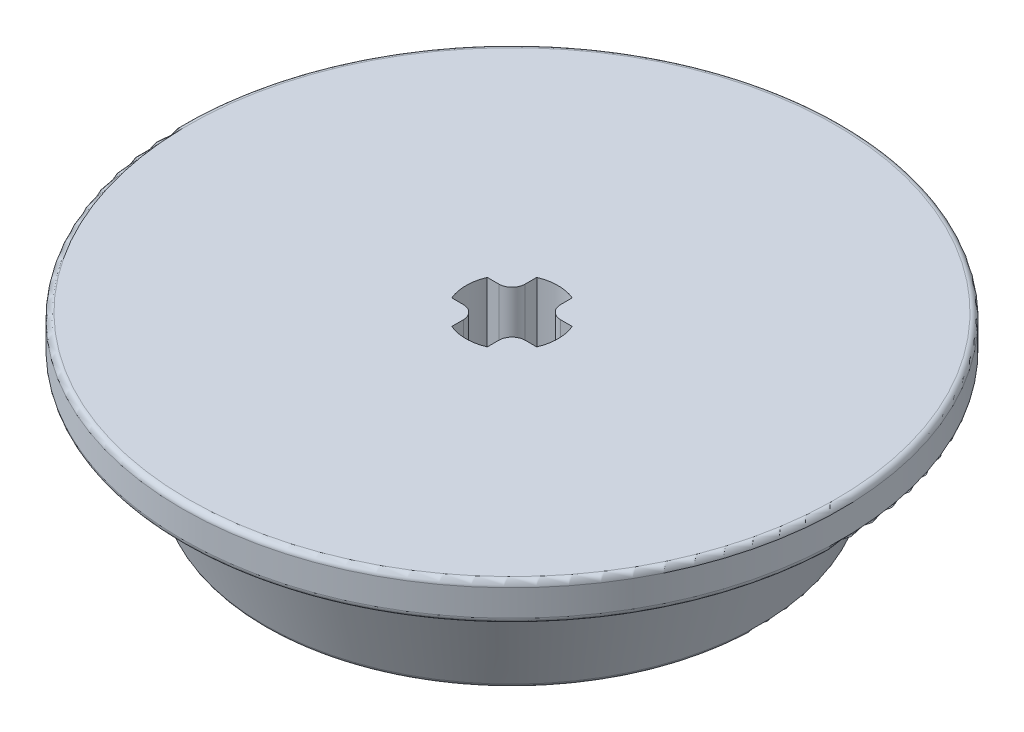
from build123d import *

# Parameters (mm, degrees)
CUT_EXTRUDE1_DEPTH = 26.956426849
FILLET1_R          = 0.7
FILLET2_R          = 0.3


with BuildPart() as part:
    # Sketch2 → Revolve1 (revolve)
    with BuildSketch(Plane.XY, mode=Mode.PRIVATE) as revolve1_sk:
        Polygon((0, 0), (17.460470996, 0), (17.460470996, -2), (15, -2), (13.050481823, -8), (0, -8), align=None)
    revolve(revolve1_sk.sketch.rotate(Axis((0, 0, 0), (0, 1, 0)), 90), axis=Axis((0, 0, 0), (0, 1, 0)))

    # Sketch1 → Cut-Extrude1 (cut, through all)
    with BuildSketch(Plane(origin=(0, 0, 0), x_dir=(1, 0, 0), z_dir=(0, 1, 0))):
        with BuildLine():
            Line((-0.94, 0.94), (-2.25166605, 0.94))
            ThreePointArc((-2.25166605, 0.94), (-2.44, 0), (-2.25166605, -0.94))
            Line((-2.25166605, -0.94), (-0.94, -0.94))
            Line((-0.94, -0.94), (-0.94, -2.25166605))
            ThreePointArc((-0.94, -2.25166605), (0, -2.44), (0.94, -2.25166605))
            Line((0.94, -2.25166605), (0.94, -0.94))
            Line((0.94, -0.94), (2.25166605, -0.94))
            ThreePointArc((2.25166605, -0.94), (2.44, 0), (2.25166605, 0.94))
            Line((2.25166605, 0.94), (0.94, 0.94))
            Line((0.94, 0.94), (0.94, 2.25166605))
            ThreePointArc((0.94, 2.25166605), (0, 2.44), (-0.94, 2.25166605))
            Line((-0.94, 2.25166605), (-0.94, 0.94))
        make_face()
    extrude(amount=-CUT_EXTRUDE1_DEPTH, mode=Mode.SUBTRACT)

    # Fillet1
    fillet1_edges = [part.edges().sort_by_distance(p)[0] for p in [
        (-0.94, -4, -0.94),
        (0.94, -4, -0.94),
        (0.94, -4, 0.94),
        (-0.94, -4, 0.94),
    ]]
    fillet(fillet1_edges, radius=FILLET1_R)

    # Fillet2
    fillet2_edges = [part.edges().sort_by_distance(p)[0] for p in [
        (0, -8, 13.050481823),
        (0, -2, 15),
        (0, -2, 17.460470996),
        (0, 0, 17.460470996),
    ]]
    fillet(fillet2_edges, radius=FILLET2_R)


solid = part.part
